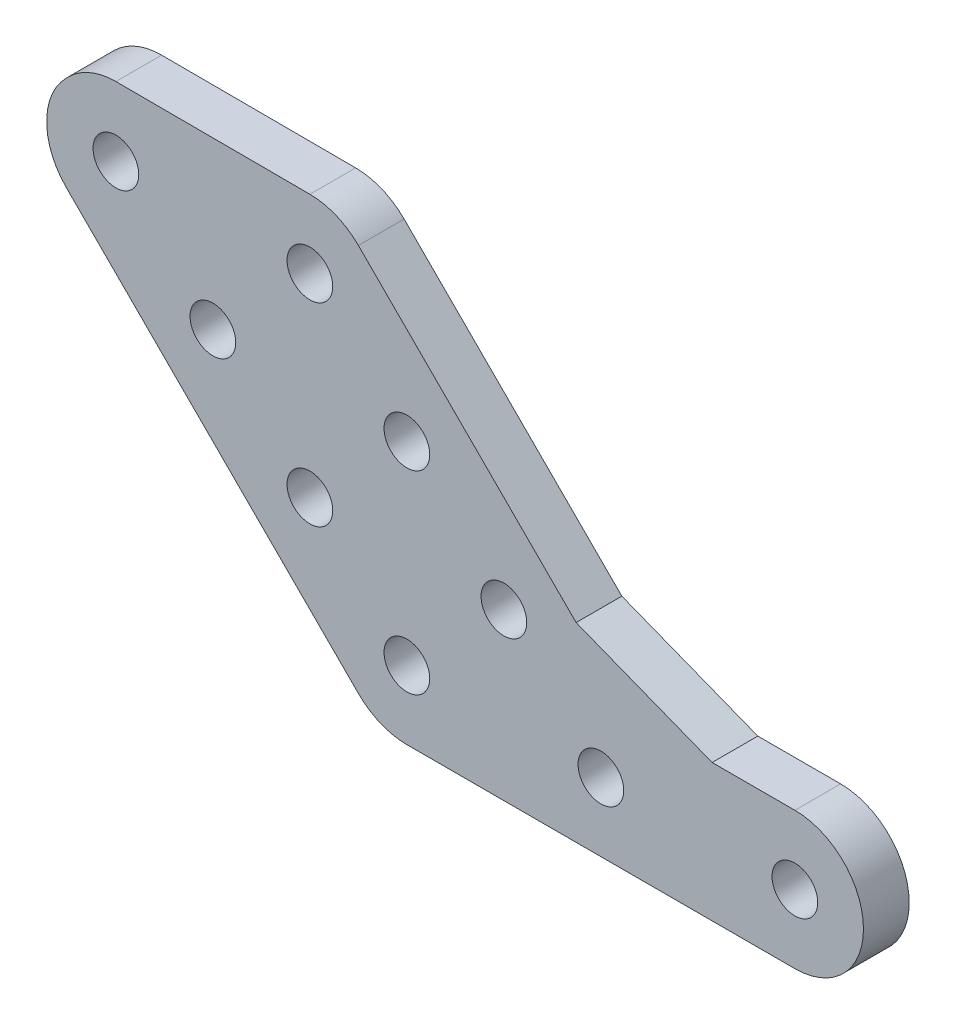
from build123d import *

# Parameters (mm, degrees)
MODEL_R                 = 1.5
SALIENTE_EXTRUIR1_DEPTH = 3


with BuildPart() as part:
    # Model → Saliente-Extruir1 (new body)
    with BuildSketch(Plane.XY):
        with BuildLine():
            Line((198.613156537, 287.328333228), (193.181176022, 287.328333228))
            Line((193.181176022, 287.328333228), (184.260234476, 290.817294259))
            Line((184.260234476, 290.817294259), (169.975331899, 305.102196835))
            ThreePointArc((169.975331899, 305.102196835), (168.51542683, 306.077674216), (166.793351384, 306.42021632))
            Line((166.793351384, 306.42021632), (154.094067467, 306.461544477))
            Line((154.094067467, 306.461544477), (154.065429323, 306.461637676))
            ThreePointArc((154.065429323, 306.461637676), (152.38162222, 306.126707619), (150.954159485, 305.172907513))
            Line((150.954159485, 305.172907513), (150.812738129, 305.031486157))
            ThreePointArc((150.812738129, 305.031486157), (149.524007966, 301.92021632), (150.812738129, 298.808946483))
            Line((150.812738129, 298.808946483), (169.975331899, 279.646352713))
            ThreePointArc((169.975331899, 279.646352713), (171.435236969, 278.670875332), (173.157312415, 278.328333228))
            Line((173.157312415, 278.328333228), (198.613156537, 278.328333228))
            ThreePointArc((198.613156537, 278.328333228), (203.113156537, 282.828333228), (198.613156537, 287.328333228))
        make_face()
        with Locations((173.157312415, 282.828333228)):
            Circle(MODEL_R, mode=Mode.SUBTRACT)
        with Locations((166.793351384, 289.192294259)):
            Circle(MODEL_R, mode=Mode.SUBTRACT)
        with Locations((185.885234476, 282.828333228)):
            Circle(MODEL_R, mode=Mode.SUBTRACT)
        with Locations((198.613156537, 282.828333228)):
            Circle(MODEL_R, mode=Mode.SUBTRACT)
        with Locations((179.521273445, 289.192294259)):
            Circle(MODEL_R, mode=Mode.SUBTRACT)
        with Locations((160.429390353, 295.556255289)):
            Circle(MODEL_R, mode=Mode.SUBTRACT)
        with Locations((173.157312415, 295.556255289)):
            Circle(MODEL_R, mode=Mode.SUBTRACT)
        with Locations((154.065429323, 301.92021632)):
            Circle(MODEL_R, mode=Mode.SUBTRACT)
        with Locations((166.793351384, 301.92021632)):
            Circle(MODEL_R, mode=Mode.SUBTRACT)
    extrude(amount=SALIENTE_EXTRUIR1_DEPTH)


solid = part.part
